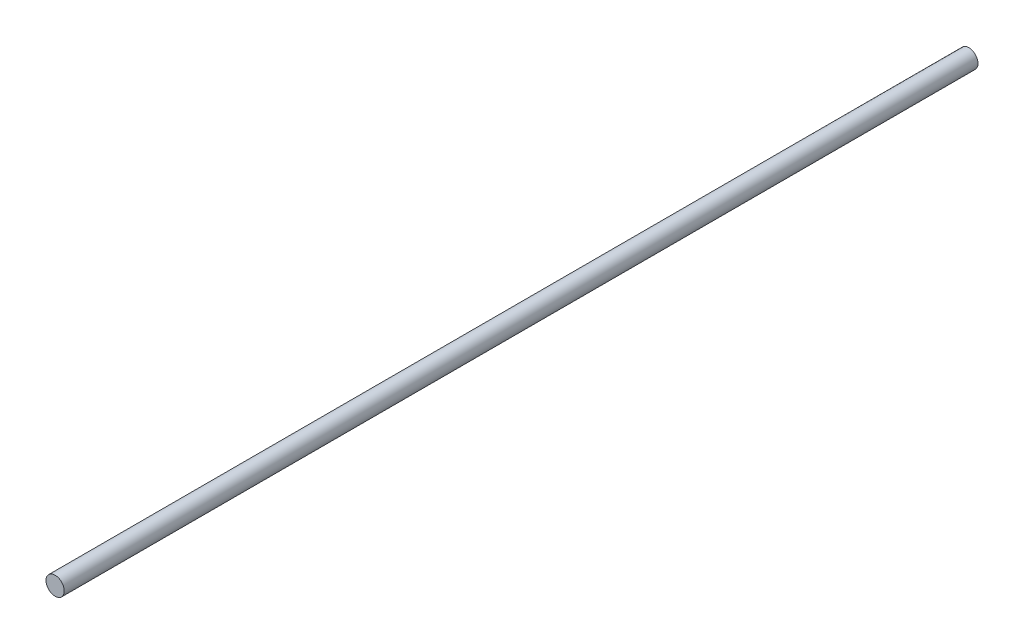
from build123d import *

# Parameters (mm, degrees)
SKETCH_1_R      = 10
EXTRUDE_1_DEPTH = 500


with BuildPart() as part:
    # Эскиз1 → Бобышка-Вытянуть1 (new, symmetric)
    with BuildSketch(Plane.XY):
        Circle(SKETCH_1_R)
    extrude(amount=EXTRUDE_1_DEPTH, both=True)


solid = part.part
